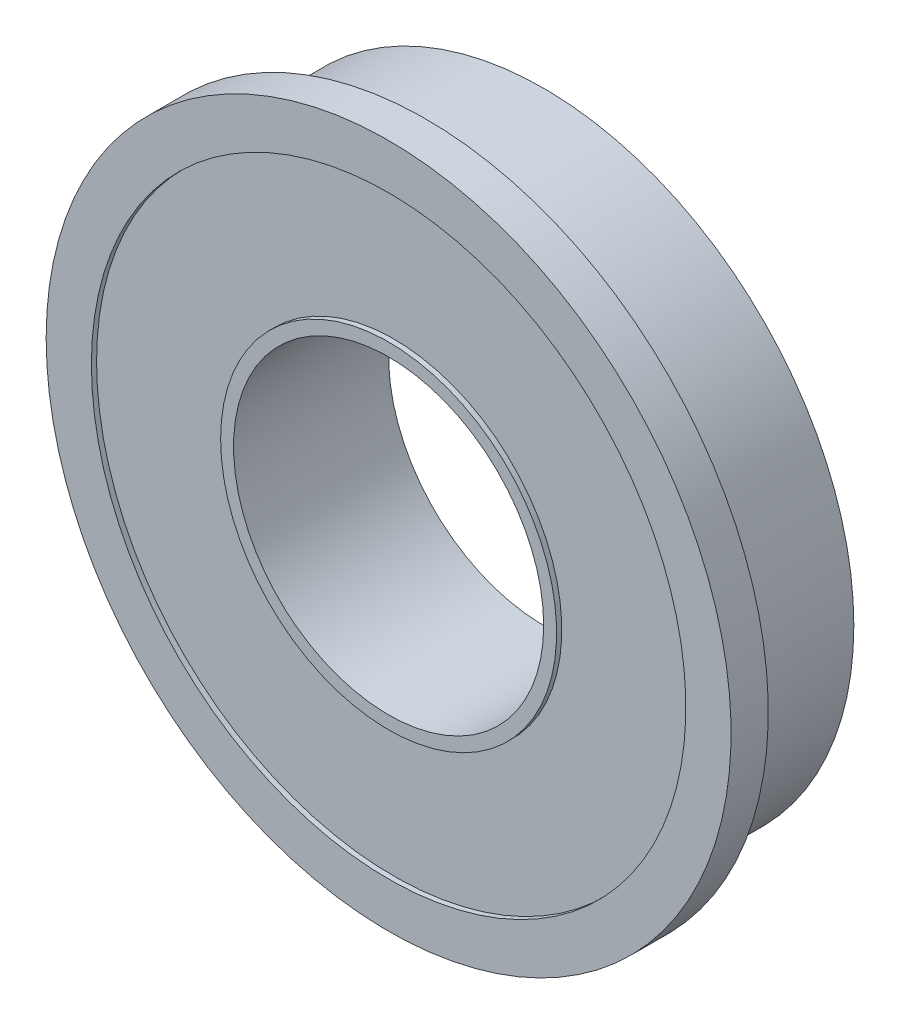
from build123d import *

# Parameters (mm, degrees)
SKETCH_1_R          = 13.25
SKETCH_1_R_2        = 12
EXTRUDE_1_DEPTH     = 1.44
EXTRUDE_START       = -6
SKETCH_2_R          = 12
SKETCH_2_R_2        = 6
EXTRUDE_2_DEPTH     = 6
SKETCH_3_R          = 11.5
SKETCH_3_R_2        = 6.5
CUT_EXTRUDE_1_DEPTH = 0.2


with BuildPart() as part:
    # 草图1 → 凸台-拉伸1 (new body)
    with BuildSketch(Plane.XY):
        with Locations(Location((0, 0, 0), (0, 0, 180))):
            Circle(SKETCH_1_R)
        with Locations(Location((0, 0, 0), (0, 0, 180))):
            Circle(SKETCH_1_R_2, mode=Mode.SUBTRACT)
    extrude(amount=EXTRUDE_1_DEPTH)

    # 草图2 → 凸台-拉伸2 (add)
    with BuildSketch(Plane.XY.offset(1.44).offset(EXTRUDE_START)):
        Circle(SKETCH_2_R)
        Circle(SKETCH_2_R_2, mode=Mode.SUBTRACT)
    extrude(amount=EXTRUDE_2_DEPTH)

    # 草图3 → 切除-拉伸1 (cut)
    with BuildSketch(Plane(origin=(0, 0, -4.56), x_dir=(-1, 0, 0), z_dir=(0, 0, -1))):
        Circle(SKETCH_3_R)
        Circle(SKETCH_3_R_2, mode=Mode.SUBTRACT)
    cut_extrude_1 = extrude(amount=-CUT_EXTRUDE_1_DEPTH, mode=Mode.SUBTRACT)

    # 镜向1: 切除-拉伸1 across plane
    add(cut_extrude_1.mirror(Plane(origin=(0, 0, -1.56), x_dir=(1, 0, 0), z_dir=(0, 0, -1))), mode=Mode.SUBTRACT)


solid = part.part
